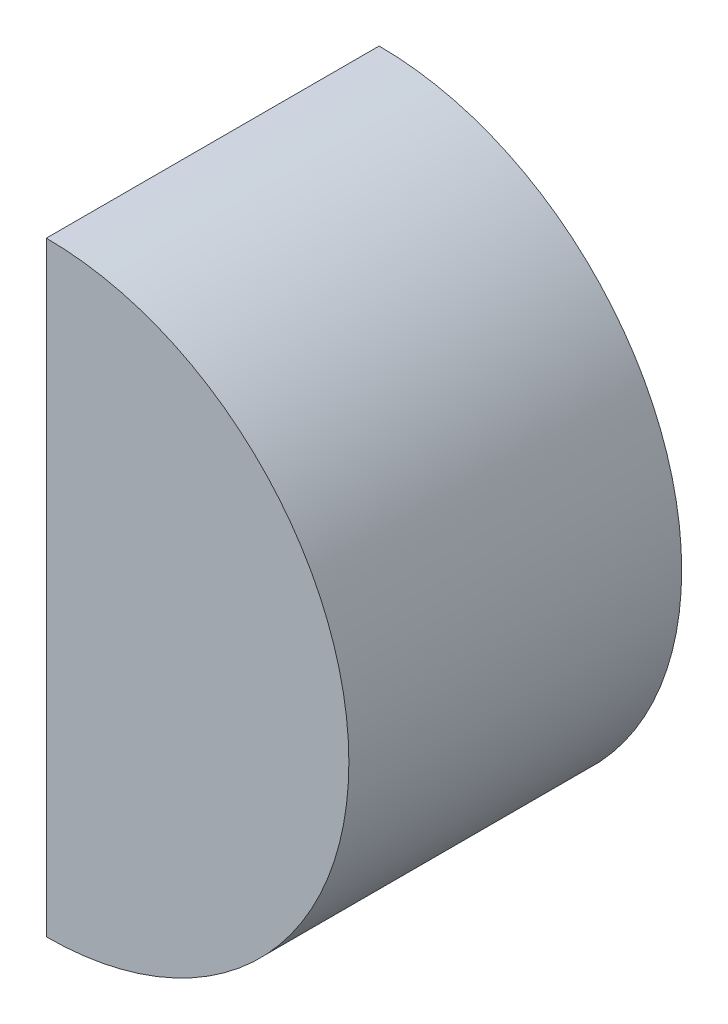
from build123d import *

# Parameters (mm, degrees)
BOSS_EXTRUDE1_DEPTH = 11


with BuildPart() as part:
    # Sketch1 → Boss-Extrude1 (new body)
    with BuildSketch(Plane.XY):
        with BuildLine():
            Line((12, 27), (12, 7))
            ThreePointArc((12, 7), (22, 17), (12, 27))
        make_face()
    extrude(amount=BOSS_EXTRUDE1_DEPTH)


solid = part.part
